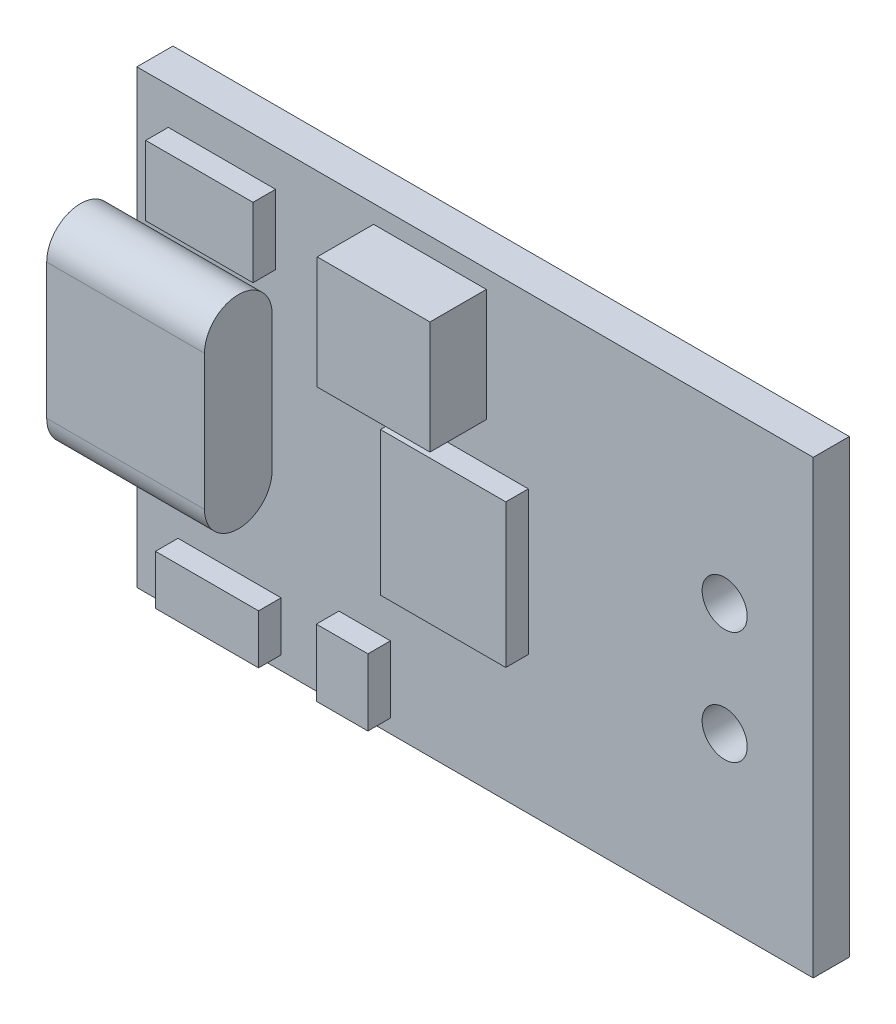
from build123d import *

# Parameters (mm, degrees)
SKICA1_W                     = 30
SKICA1_H                     = 20
P_IDAT_VYSUNUT_M1_DEPTH      = 1.6
SKICA2_W                     = 5
SKICA2_H                     = 5
P_IDAT_VYSUNUT_M2_DEPTH      = 2.5
SKICA3_W                     = 5.560208965
SKICA3_H                     = 6.363350261
SKICA3_W_2                   = 2.285863686
SKICA3_H_2                   = 2.965444781
SKICA3_W_3                   = 4.571727371
SKICA3_H_3                   = 2.193193536
SKICA3_W_4                   = 4.75706767
SKICA3_H_4                   = 3.089004981
P_IDAT_VYSUNUT_M3_DEPTH      = 1
SKICA4_R                     = 1
ODEBRAT_VYSUNUT_M1_DEPTH     = 11
P_IDAT_VYSUNUT_M4_DEPTH      = 1
P_IDAT_VYSUNUT_M4_DEPTH_BACK = 6
SKICA6_W                     = 0.458188224
SKICA6_H                     = 5.040283318
ODEBRAT_VYSUNUT_M2_DEPTH     = 6


with BuildPart() as part:
    # Skica1 → Přidat vysunutím1 (new body)
    with BuildSketch(Plane.XY):
        with Locations((15, 10)):
            Rectangle(SKICA1_W, SKICA1_H)
    extrude(amount=P_IDAT_VYSUNUT_M1_DEPTH)

    # Skica2 → Přidat vysunutím2 (add)
    with BuildSketch(Plane.XY.offset(1.6)):
        with Locations((13, 16.7)):
            Rectangle(SKICA2_W, SKICA2_H)
    extrude(amount=P_IDAT_VYSUNUT_M2_DEPTH)

    # Skica3 → Přidat vysunutím3 (add)
    with BuildSketch(Plane.XY.offset(1.6)):
        with Locations((14.582984328, 9.289528855)):
            Rectangle(SKICA3_W, SKICA3_H)
        with Locations((10.103927106, 2.092147249)):
            Rectangle(SKICA3_W_2, SKICA3_H_2)
        with Locations((4.111257444, 1.706021627)):
            Rectangle(SKICA3_W_3, SKICA3_H_3)
        with Locations((3.771466895, 16.826701007)):
            Rectangle(SKICA3_W_4, SKICA3_H_4)
    extrude(amount=P_IDAT_VYSUNUT_M3_DEPTH)

    # Skica4 → Odebrat vysunutím1 (cut)
    with BuildSketch(Plane.XY.offset(1.6)):
        with Locations((26.071400283, 12.424560679)):
            Circle(SKICA4_R)
        with Locations((26.071400283, 7.424560679)):
            Circle(SKICA4_R)
    extrude(amount=-ODEBRAT_VYSUNUT_M1_DEPTH, mode=Mode.SUBTRACT)

    # Skica5 → Přidat vysunutím4 (add, two sides: drawn at the far end of the back side and taken through both)
    with BuildSketch(Plane.ZY.offset(-P_IDAT_VYSUNUT_M4_DEPTH_BACK)):
        with BuildLine():
            Line((4.6, 13.5), (4.6, 7.5))
            ThreePointArc((4.6, 7.5), (3.1, 6), (1.6, 7.5))
            Line((1.6, 7.5), (1.6, 13.5))
            ThreePointArc((1.6, 13.5), (3.1, 15), (4.6, 13.5))
        make_face()
    extrude(amount=P_IDAT_VYSUNUT_M4_DEPTH + P_IDAT_VYSUNUT_M4_DEPTH_BACK)

    # Skica6 → Odebrat vysunutím2 (cut)
    with BuildSketch(Plane.ZY.offset(1)):
        with BuildLine():
            Line((1.9, 13.5), (1.9, 7.5))
            ThreePointArc((1.9, 7.5), (3.1, 6.3), (4.3, 7.5))
            Line((4.3, 7.5), (4.3, 13.5))
            ThreePointArc((4.3, 13.5), (3.1, 14.7), (1.9, 13.5))
        make_face()
        with Locations((3.1, 10.5)):
            Rectangle(SKICA6_W, SKICA6_H, mode=Mode.SUBTRACT)
    extrude(amount=-ODEBRAT_VYSUNUT_M2_DEPTH, mode=Mode.SUBTRACT)


solid = part.part
